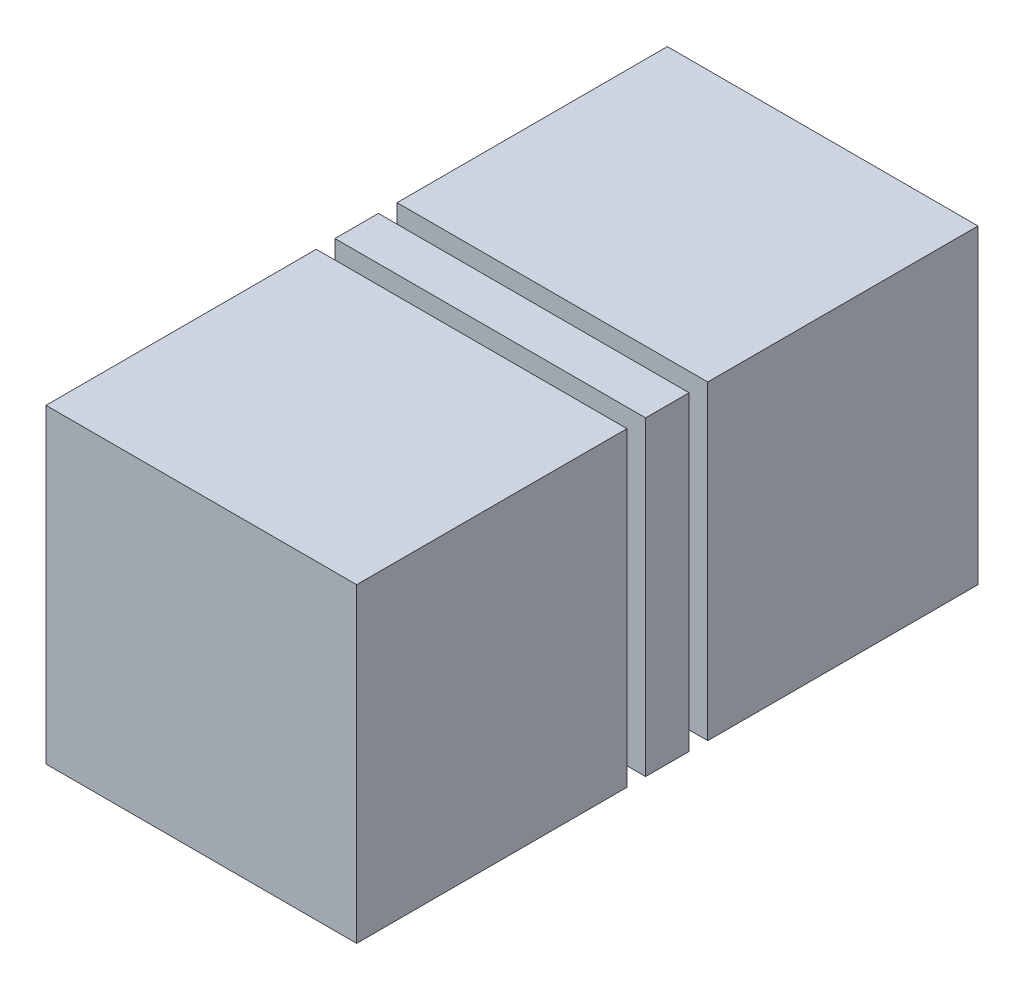
from build123d import *

# Parameters (mm, degrees)
SKETCH1_W           = 100
SKETCH1_H           = 50
BOSS_EXTRUDE1_DEPTH = 25
SKETCH2_W           = 50
SKETCH2_H           = 50
SKETCH2_W_2         = 44
SKETCH2_H_2         = 44
CUT_EXTRUDE1_DEPTH  = 1.5


with BuildPart() as part:
    # Sketch1 → Boss-Extrude1 (new, symmetric)
    with BuildSketch(Plane(origin=(0, 0, 0), x_dir=(0, 0, -1), z_dir=(1, 0, 0))):
        Rectangle(SKETCH1_W, SKETCH1_H)
    extrude(amount=BOSS_EXTRUDE1_DEPTH, both=True)

    # Sketch2 → Cut-Extrude1 (cut, symmetric)
    with BuildSketch(Plane.XY.offset(5)):
        Rectangle(SKETCH2_W, SKETCH2_H)
        Rectangle(SKETCH2_W_2, SKETCH2_H_2, mode=Mode.SUBTRACT)
    cut_extrude1 = extrude(amount=CUT_EXTRUDE1_DEPTH, both=True, mode=Mode.SUBTRACT)

    # Mirror1: Cut-Extrude1 across plane
    add(cut_extrude1.mirror(Plane.XY), mode=Mode.SUBTRACT)


solid = part.part
